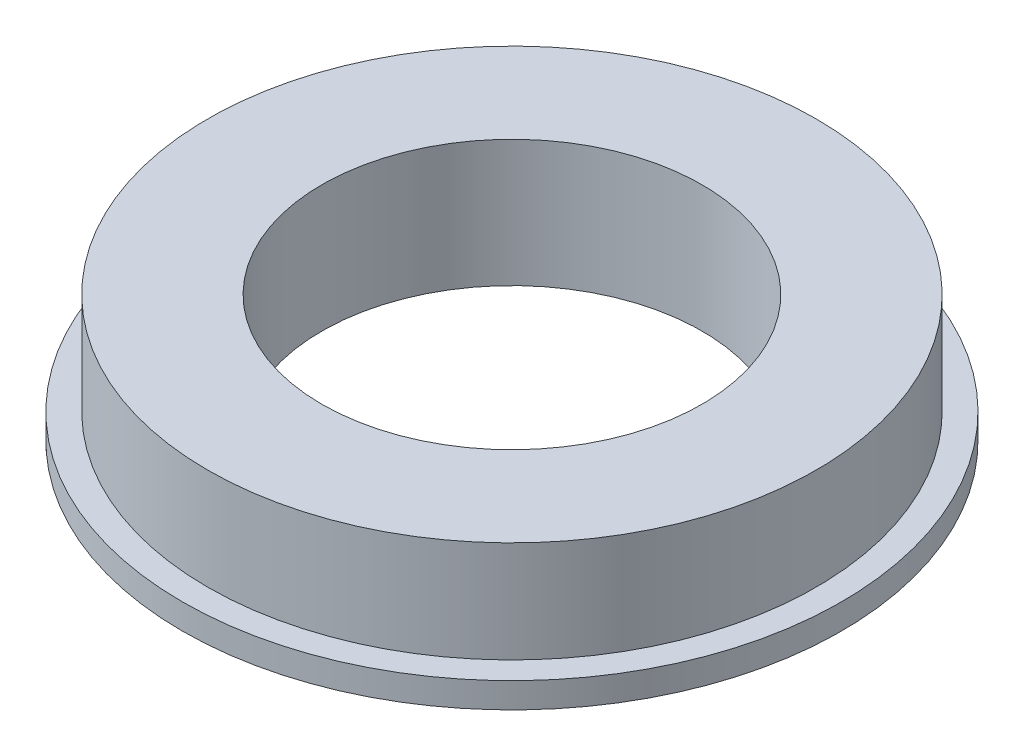
from build123d import *

# Parameters (mm, degrees)
SKETCH_1_R      = 12
SKETCH_1_R_2    = 7.5
EXTRUDE_1_DEPTH = 5
SKETCH_1_3_R    = 13
SKETCH_1_3_R_2  = 12
EXTRUDE_2_DEPTH = 1


with BuildPart() as part:
    # 草图1 → 凸台-拉伸1 (new body)
    with BuildSketch(Plane(origin=(0, 0, 0), x_dir=(1, 0, 0), z_dir=(0, 1, 0))):
        Circle(SKETCH_1_R)
        Circle(SKETCH_1_R_2, mode=Mode.SUBTRACT)
    extrude(amount=EXTRUDE_1_DEPTH)

    # 草图1<3> → 凸台-拉伸2 (add)
    with BuildSketch(Plane(origin=(0, 0, 0), x_dir=(1, 0, 0), z_dir=(0, 1, 0))):
        Circle(SKETCH_1_3_R)
        Circle(SKETCH_1_3_R_2, mode=Mode.SUBTRACT)
    extrude(amount=EXTRUDE_2_DEPTH)


solid = part.part
